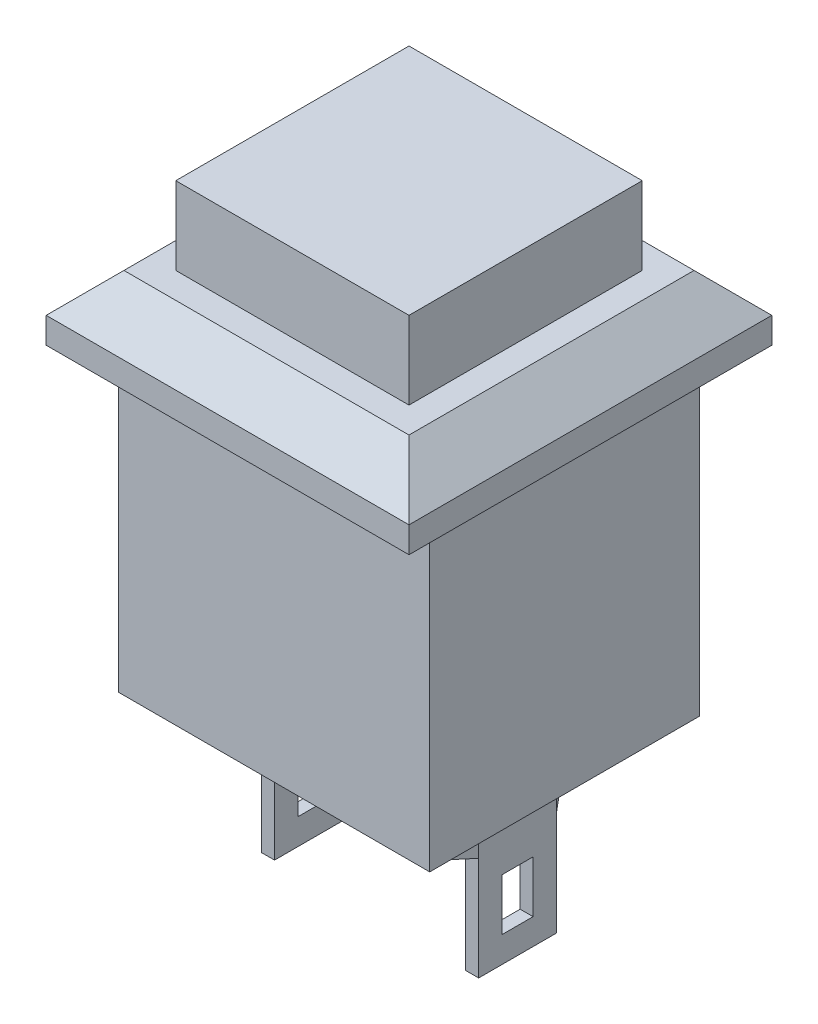
from build123d import *

# Parameters (mm, degrees)
SKETCH_1_W          = 9
SKETCH_1_H          = 9
EXTRUDE_1_DEPTH     = 3
SKETCH_2_W          = 14
SKETCH_2_H          = 14
EXTRUDE_2_DEPTH     = 2.5
CHAMFER_1_SIZE      = 1.5
SKETCH_3_W          = 12
SKETCH_3_H          = 10.4
EXTRUDE_3_DEPTH     = 12
EXTRUDE_4_DEPTH     = 2.3
SKETCH_5_W          = 0.5
SKETCH_5_H          = 3
EXTRUDE_5_DEPTH     = 4
SKETCH_6_W          = 1.2
SKETCH_6_H          = 2
CUT_EXTRUDE_1_DEPTH = 4


with BuildPart() as part:
    # Эскиз1 → Бобышка-Вытянуть1 (new body)
    with BuildSketch(Plane(origin=(0, 0, 0), x_dir=(1, 0, 0), z_dir=(0, 1, 0))):
        Rectangle(SKETCH_1_W, SKETCH_1_H)
    extrude(amount=EXTRUDE_1_DEPTH)

    # Эскиз2 → Бобышка-Вытянуть2 (add)
    with BuildSketch(Plane.XZ):
        Rectangle(SKETCH_2_W, SKETCH_2_H)
    extrude(amount=EXTRUDE_2_DEPTH)

    # Фаска1
    chamfer_1_edges = [part.edges().sort_by_distance(p)[0] for p in [
        (7, 0, 0),
        (0, 0, 7),
        (-7, 0, 0),
        (0, 0, -7),
    ]]
    chamfer(chamfer_1_edges, length=CHAMFER_1_SIZE)

    # Эскиз3 → Бобышка-Вытянуть3 (add)
    with BuildSketch(Plane.XZ.offset(2.5)):
        Rectangle(SKETCH_3_W, SKETCH_3_H)
    extrude(amount=EXTRUDE_3_DEPTH)

    # Эскиз4 → Бобышка-Вытянуть4 (add)
    with BuildSketch(Plane.XZ.offset(14.5)):
        Polygon((4.188675038, -1.5), (4.188675038, 1.5), (3.342315947, 2.5), (2.960661433, 2.176983233), (3.688675038, 1.316812163), (3.688675038, -1.316812163), (2.960661433, -2.176983233), (3.342315947, -2.5), align=None)
    extrude_4 = extrude(amount=EXTRUDE_4_DEPTH)

    # Эскиз5 → Бобышка-Вытянуть5 (add)
    with BuildSketch(Plane.XZ.offset(16.8)):
        with Locations((3.938675038, 0)):
            Rectangle(SKETCH_5_W, SKETCH_5_H)
    extrude_5 = extrude(amount=EXTRUDE_5_DEPTH)

    # Эскиз6 → Вырез-Вытянуть1 (cut)
    with BuildSketch(Plane.ZY.offset(-3.688675038)):
        with Locations((0, -18.8)):
            Rectangle(SKETCH_6_W, SKETCH_6_H)
    cut_extrude_1 = extrude(amount=-CUT_EXTRUDE_1_DEPTH, mode=Mode.SUBTRACT)

    # Зеркальное отражение1: Бобышка-Вытянуть4, Бобышка-Вытянуть5, Вырез-Вытянуть1 across plane
    add(extrude_4.mirror(Plane(origin=(0, 0, 0), x_dir=(0, 0, 1), z_dir=(1, 0, 0))))
    add(extrude_5.mirror(Plane(origin=(0, 0, 0), x_dir=(0, 0, 1), z_dir=(1, 0, 0))))
    add(cut_extrude_1.mirror(Plane(origin=(0, 0, 0), x_dir=(0, 0, 1), z_dir=(1, 0, 0))), mode=Mode.SUBTRACT)


solid = part.part
